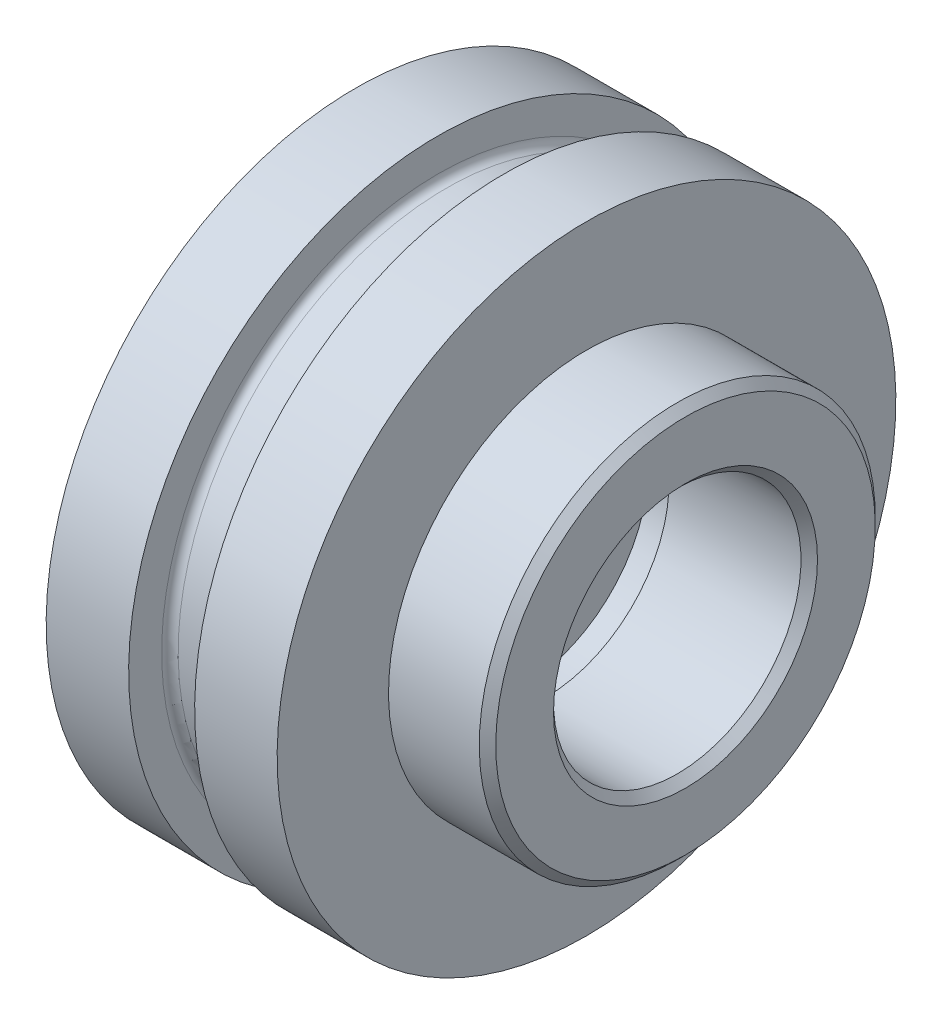
from build123d import *


with BuildPart() as part:
    # Эскиз1 → Повернуть1 (revolve)
    with BuildSketch(Plane.XY, mode=Mode.PRIVATE) as revolve_1_sk:
        with BuildLine():
            Line((0, 34.5), (0, 37.5))
            Line((0, 37.5), (10, 37.5))
            Line((10, 37.5), (10, 33.5))
            ThreePointArc((10, 33.5), (10.292893219, 32.792893219), (11, 32.5))
            Line((11, 32.5), (17, 32.5))
            ThreePointArc((17, 32.5), (17.707106781, 32.792893219), (18, 33.5))
            Line((18, 33.5), (18, 37.5))
            Line((18, 37.5), (28, 37.5))
            Line((28, 37.5), (28, 24))
            Line((28, 24), (39, 24))
            Line((39, 24), (40, 23))
            Line((40, 23), (40, 16))
            Line((40, 16), (39, 15))
            Line((39, 15), (23, 15))
            Line((23, 15), (23, 15.5))
            Line((23, 15.5), (20, 15.5))
            Line((20, 15.5), (20, 0))
            Line((20, 0), (2, 0))
            Line((2, 0), (2, 34.5))
            Line((2, 34.5), (0, 34.5))
        make_face()
    revolve(revolve_1_sk.sketch.rotate(Axis((2, 0, 0), (1, 0, 0)), 180), axis=Axis((2, 0, 0), (1, 0, 0)))


solid = part.part
